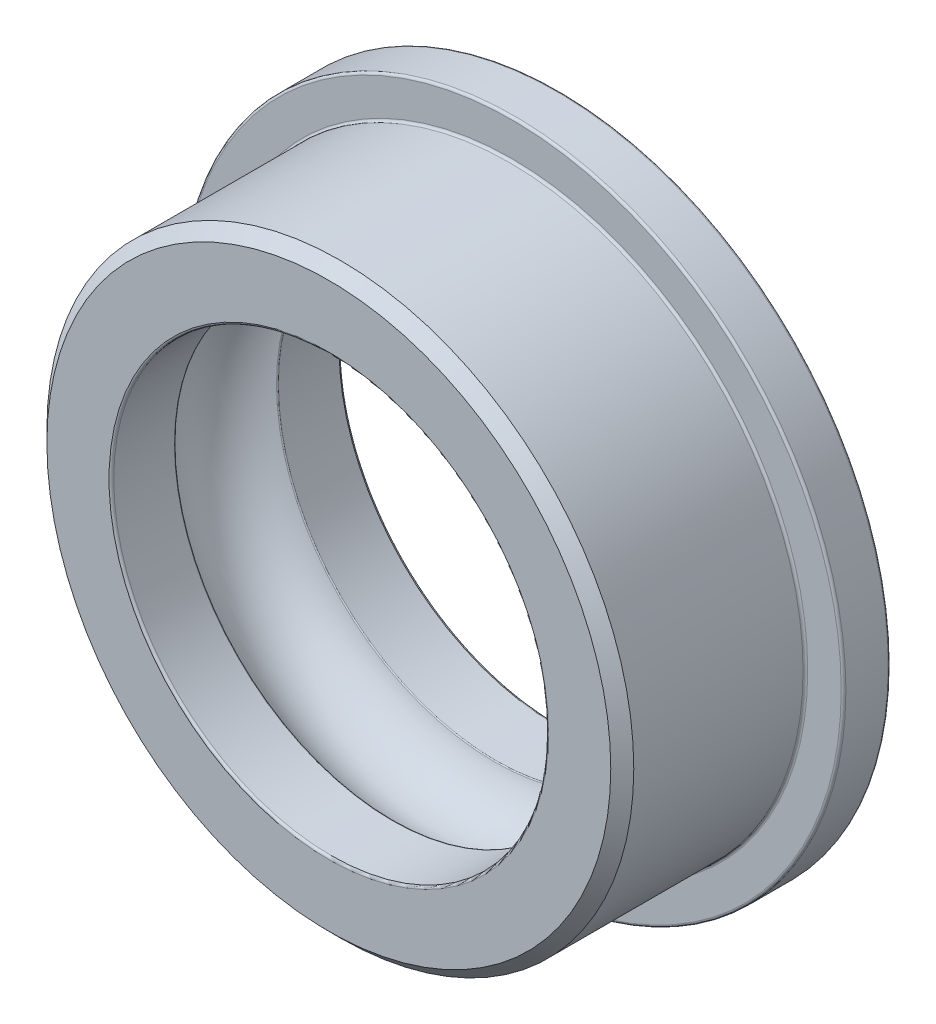
from build123d import *


with BuildPart() as part:
    # Outer Bearing Race Profile → Outer Bearing Race (revolve)
    with BuildSketch(Plane(origin=(0, 0, 0), x_dir=(0, 0, -1), z_dir=(1, 0, 0))):
        with BuildLine():
            Line((1.4224, 6.35), (-2.24028, 6.35))
            Line((-2.24028, 6.35), (-2.4892, 6.10108))
            Line((-2.4892, 6.10108), (-2.4892, 4.755835989))
            ThreePointArc((-2.4892, 4.755835989), (-2.474321024, 4.719914965), (-2.4384, 4.705035989))
            Line((-2.4384, 4.705035989), (-1.12493032, 4.705035989))
            ThreePointArc((-1.12493032, 4.705035989), (-1.109994783, 4.709891167), (-1.100769063, 4.722600578))
            ThreePointArc((-1.100769063, 4.722600578), (0, 5.522830295), (1.100769063, 4.722600578))
            ThreePointArc((1.100769063, 4.722600578), (1.109994783, 4.709891167), (1.12493032, 4.705035989))
            Line((1.12493032, 4.705035989), (2.4384, 4.705035989))
            ThreePointArc((2.4384, 4.705035989), (2.474321024, 4.719914965), (2.4892, 4.755835989))
            Line((2.4892, 4.755835989), (2.4892, 7.1247))
            ThreePointArc((2.4892, 7.1247), (2.474321024, 7.160621024), (2.4384, 7.1755))
            Line((2.4384, 7.1755), (1.524, 7.1755))
            ThreePointArc((1.524, 7.1755), (1.488078976, 7.160621024), (1.4732, 7.1247))
            Line((1.4732, 7.1247), (1.4732, 6.4008))
            ThreePointArc((1.4732, 6.4008), (1.458321024, 6.364878976), (1.4224, 6.35))
        make_face()
    revolve(axis=Axis((0, 0, 2.4892), (0, 0, -1)))


solid = part.part
